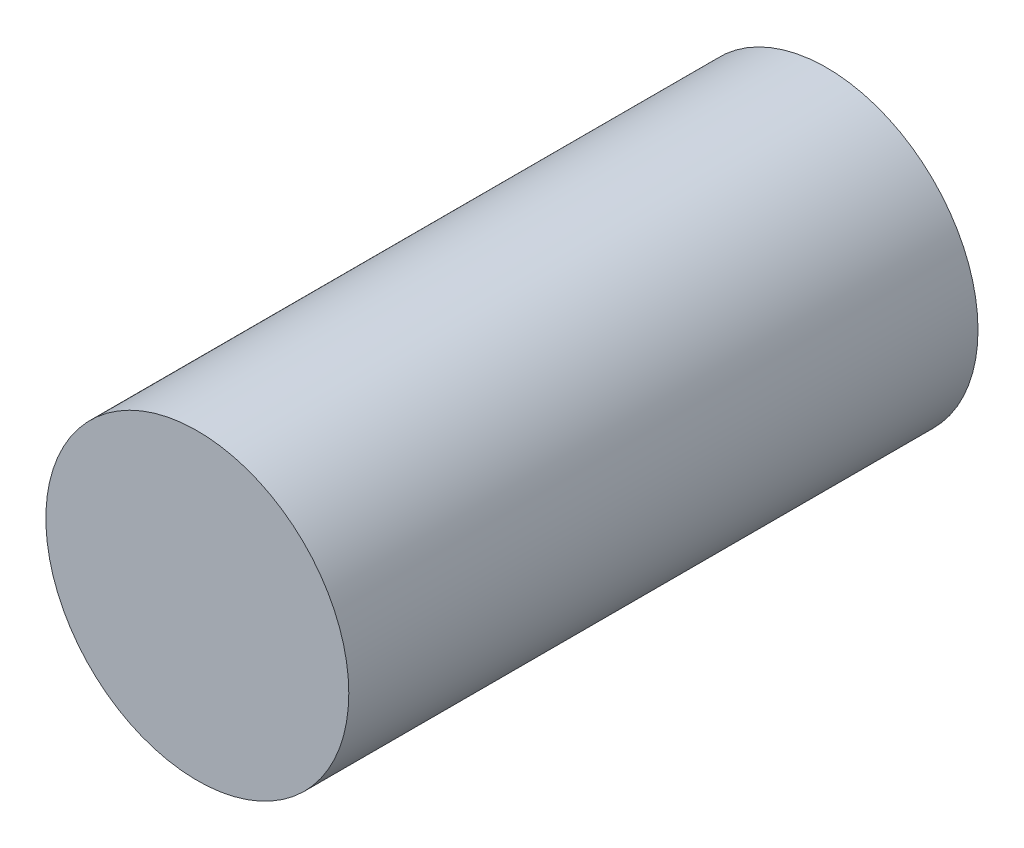
from build123d import *

# Parameters (mm, degrees)
SKETCH_1_R          = 6.5
EXTRUDE_1_DEPTH     = 27
SKETCH_2_R          = 1.5
CUT_EXTRUDE_1_DEPTH = 8


with BuildPart() as part:
    # 草图1 → 凸台-拉伸1 (new body)
    with BuildSketch(Plane.XY):
        Circle(SKETCH_1_R)
    extrude(amount=EXTRUDE_1_DEPTH)

    # 草图2 → 切除-拉伸1 (cut)
    with BuildSketch(Plane(origin=(0, 0, 0), x_dir=(-1, 0, 0), z_dir=(0, 0, -1))):
        Circle(SKETCH_2_R)
    extrude(amount=-CUT_EXTRUDE_1_DEPTH, mode=Mode.SUBTRACT)


solid = part.part
